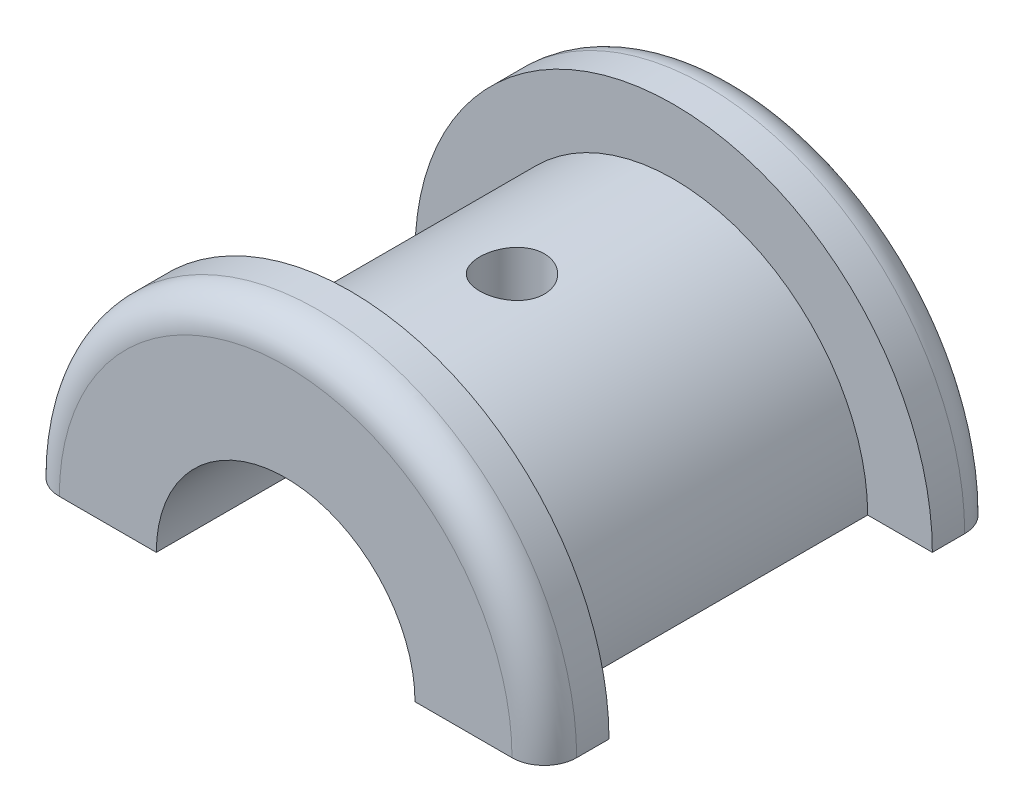
from build123d import *

# Parameters (mm, degrees)
BOSS_EXTRUDE1_DEPTH = 7
CUT_EXTRUDE1_DEPTH  = 5
FILLET1_R           = 1
SKETCH3_R           = 1
CUT_EXTRUDE2_DEPTH  = 14.304134756


with BuildPart() as part:
    # Sketch1 → Boss-Extrude1 (new, symmetric)
    with BuildSketch(Plane.XY):
        with BuildLine():
            Line((-8, 0), (-4, 0))
            ThreePointArc((-4, 0), (0, 4), (4, 0))
            Line((4, 0), (8, 0))
            ThreePointArc((8, 0), (0, 8), (-8, 0))
        make_face()
    extrude(amount=BOSS_EXTRUDE1_DEPTH, both=True)

    # Sketch2 → Cut-Extrude1 (cut, symmetric)
    with BuildSketch(Plane.XY):
        with BuildLine():
            Line((-8, 0), (-6, 0))
            ThreePointArc((-6, 0), (0, 6), (6, 0))
            Line((6, 0), (8, 0))
            ThreePointArc((8, 0), (0, 8), (-8, 0))
        make_face()
    extrude(amount=CUT_EXTRUDE1_DEPTH, both=True, mode=Mode.SUBTRACT)

    # Fillet1
    fillet1_edges = [part.edges().sort_by_distance(p)[0] for p in [
        (0, 8, 7),
        (0, 8, -7),
    ]]
    fillet(fillet1_edges, radius=FILLET1_R)

    # Sketch3 → Cut-Extrude2 (cut, through all)
    with BuildSketch(Plane(origin=(0, 0, 0), x_dir=(1, 0, 0), z_dir=(0, 1, 0))):
        with Locations(Location((0, 0, 0), (0, 0, 90))):
            Circle(SKETCH3_R)
    extrude(amount=CUT_EXTRUDE2_DEPTH, mode=Mode.SUBTRACT)


solid = part.part
